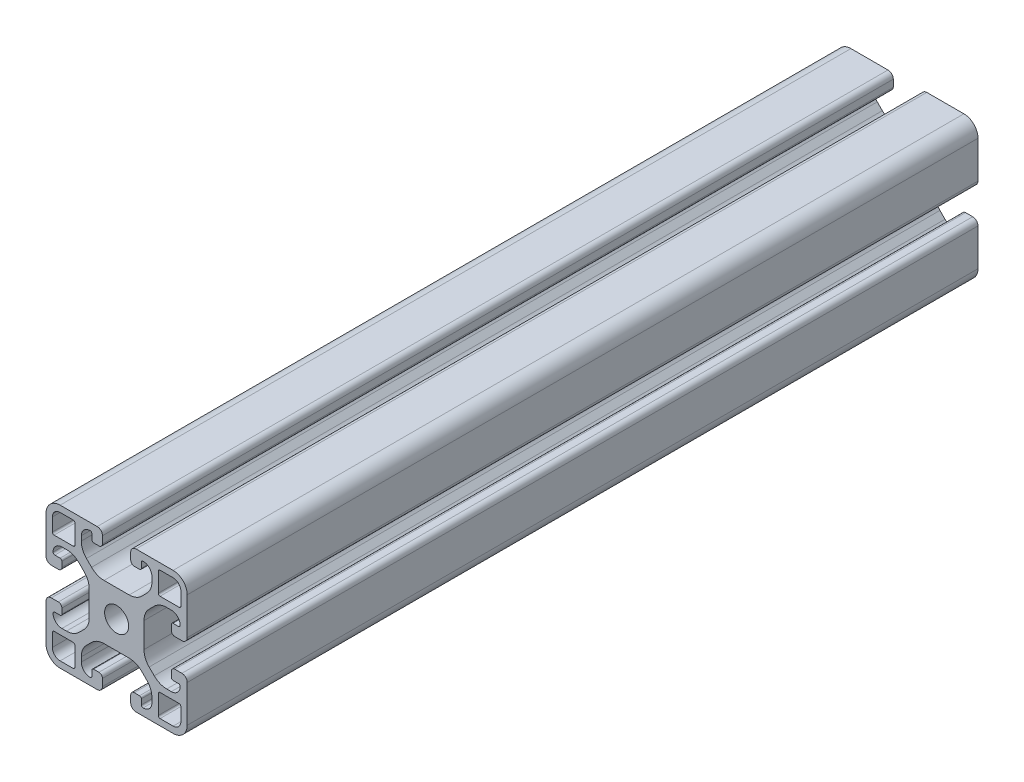
from build123d import *

# Parameters (mm, degrees)
ESQUISSE1_R      = 3.4
EXTRUSION1_DEPTH = 224


with BuildPart() as part:
    # Esquisse1 → Extrusion1 (new body)
    with BuildSketch(Plane.XY.offset(20)):
        with BuildLine():
            Line((3.5, 16), (1.5, 16))
            ThreePointArc((1.5, 16), (0.439339828, 15.560660172), (0, 14.5))
            Line((0, 14.5), (0, 4))
            ThreePointArc((0, 4), (1.171572875, 1.171572875), (4, 0))
            Line((4, 0), (14.5, 0))
            ThreePointArc((14.5, 0), (15.560660172, 0.439339828), (16, 1.5))
            Line((16, 1.5), (16, 3.5))
            ThreePointArc((16, 3.5), (15.707106781, 4.207106781), (15, 4.5))
            Line((15, 4.5), (13.5, 4.5))
            ThreePointArc((13.5, 4.5), (13.146446609, 4.353553391), (13, 4))
            Line((13, 4), (13, 2.5))
            ThreePointArc((13, 2.5), (12.853553391, 2.146446609), (12.5, 2))
            ThreePointArc((12.5, 2), (10.732233047, 2.732233047), (10, 4.5))
            Line((10, 4.5), (10, 5.807611845))
            ThreePointArc((10, 5.807611845), (10.380602337, 7.721029006), (11.464466094, 9.343145751))
            Line((11.464466094, 9.343145751), (12.906854249, 10.785533906))
            ThreePointArc((12.906854249, 10.785533906), (14.528970994, 11.869397663), (16.442388155, 12.25))
            Line((16.442388155, 12.25), (23.557611845, 12.25))
            ThreePointArc((23.557611845, 12.25), (25.471029006, 11.869397663), (27.093145751, 10.785533906))
            Line((27.093145751, 10.785533906), (28.535533906, 9.343145751))
            ThreePointArc((28.535533906, 9.343145751), (29.619397663, 7.721029006), (30, 5.807611845))
            Line((30, 5.807611845), (30, 4.5))
            ThreePointArc((30, 4.5), (29.267766953, 2.732233047), (27.5, 2))
            ThreePointArc((27.5, 2), (27.146446609, 2.146446609), (27, 2.5))
            Line((27, 2.5), (27, 4))
            ThreePointArc((27, 4), (26.853553391, 4.353553391), (26.5, 4.5))
            Line((26.5, 4.5), (25, 4.5))
            ThreePointArc((25, 4.5), (24.292893219, 4.207106781), (24, 3.5))
            Line((24, 3.5), (24, 1.5))
            ThreePointArc((24, 1.5), (24.439339828, 0.439339828), (25.5, 0))
            Line((25.5, 0), (36, 0))
            ThreePointArc((36, 0), (38.828427125, 1.171572875), (40, 4))
            Line((40, 4), (40, 14.5))
            ThreePointArc((40, 14.5), (39.560660172, 15.560660172), (38.5, 16))
            Line((38.5, 16), (36.5, 16))
            ThreePointArc((36.5, 16), (35.792893219, 15.707106781), (35.5, 15))
            Line((35.5, 15), (35.5, 13.5))
            ThreePointArc((35.5, 13.5), (35.646446609, 13.146446609), (36, 13))
            Line((36, 13), (37.5, 13))
            ThreePointArc((37.5, 13), (37.853553391, 12.853553391), (38, 12.5))
            ThreePointArc((38, 12.5), (37.267766953, 10.732233047), (35.5, 10))
            Line((35.5, 10), (34.192388155, 10))
            ThreePointArc((34.192388155, 10), (32.278970994, 10.380602337), (30.656854249, 11.464466094))
            Line((30.656854249, 11.464466094), (29.214466094, 12.906854249))
            ThreePointArc((29.214466094, 12.906854249), (28.130602337, 14.528970994), (27.75, 16.442388155))
            Line((27.75, 16.442388155), (27.75, 23.557611845))
            ThreePointArc((27.75, 23.557611845), (28.130602337, 25.471029006), (29.214466094, 27.093145751))
            Line((29.214466094, 27.093145751), (30.656854249, 28.535533906))
            ThreePointArc((30.656854249, 28.535533906), (32.278970994, 29.619397663), (34.192388155, 30))
            Line((34.192388155, 30), (35.5, 30))
            ThreePointArc((35.5, 30), (37.267766953, 29.267766953), (38, 27.5))
            ThreePointArc((38, 27.5), (37.853553391, 27.146446609), (37.5, 27))
            Line((37.5, 27), (36, 27))
            ThreePointArc((36, 27), (35.646446609, 26.853553391), (35.5, 26.5))
            Line((35.5, 26.5), (35.5, 25))
            ThreePointArc((35.5, 25), (35.792893219, 24.292893219), (36.5, 24))
            Line((36.5, 24), (38.5, 24))
            ThreePointArc((38.5, 24), (39.560660172, 24.439339828), (40, 25.5))
            Line((40, 25.5), (40, 36))
            ThreePointArc((40, 36), (38.828427125, 38.828427125), (36, 40))
            Line((36, 40), (25.5, 40))
            ThreePointArc((25.5, 40), (24.439339828, 39.560660172), (24, 38.5))
            Line((24, 38.5), (24, 36.5))
            ThreePointArc((24, 36.5), (24.292893219, 35.792893219), (25, 35.5))
            Line((25, 35.5), (26.5, 35.5))
            ThreePointArc((26.5, 35.5), (26.853553391, 35.646446609), (27, 36))
            Line((27, 36), (27, 37.5))
            ThreePointArc((27, 37.5), (27.146446609, 37.853553391), (27.5, 38))
            ThreePointArc((27.5, 38), (29.267766953, 37.267766953), (30, 35.5))
            Line((30, 35.5), (30, 34.192388155))
            ThreePointArc((30, 34.192388155), (29.619397663, 32.278970994), (28.535533906, 30.656854249))
            Line((28.535533906, 30.656854249), (27.093145751, 29.214466094))
            ThreePointArc((27.093145751, 29.214466094), (25.471029006, 28.130602337), (23.557611845, 27.75))
            Line((23.557611845, 27.75), (16.442388155, 27.75))
            ThreePointArc((16.442388155, 27.75), (14.528970994, 28.130602337), (12.906854249, 29.214466094))
            Line((12.906854249, 29.214466094), (11.464466094, 30.656854249))
            ThreePointArc((11.464466094, 30.656854249), (10.380602337, 32.278970994), (10, 34.192388155))
            Line((10, 34.192388155), (10, 35.5))
            ThreePointArc((10, 35.5), (10.732233047, 37.267766953), (12.5, 38))
            ThreePointArc((12.5, 38), (12.853553391, 37.853553391), (13, 37.5))
            Line((13, 37.5), (13, 36))
            ThreePointArc((13, 36), (13.146446609, 35.646446609), (13.5, 35.5))
            Line((13.5, 35.5), (15, 35.5))
            ThreePointArc((15, 35.5), (15.707106781, 35.792893219), (16, 36.5))
            Line((16, 36.5), (16, 38.5))
            ThreePointArc((16, 38.5), (15.560660172, 39.560660172), (14.5, 40))
            Line((14.5, 40), (4, 40))
            ThreePointArc((4, 40), (1.171572875, 38.828427125), (0, 36))
            Line((0, 36), (0, 25.5))
            ThreePointArc((0, 25.5), (0.439339828, 24.439339828), (1.5, 24))
            Line((1.5, 24), (3.5, 24))
            ThreePointArc((3.5, 24), (4.207106781, 24.292893219), (4.5, 25))
            Line((4.5, 25), (4.5, 26.5))
            ThreePointArc((4.5, 26.5), (4.353553391, 26.853553391), (4, 27))
            Line((4, 27), (2.5, 27))
            ThreePointArc((2.5, 27), (2.146446609, 27.146446609), (2, 27.5))
            ThreePointArc((2, 27.5), (2.732233047, 29.267766953), (4.5, 30))
            Line((4.5, 30), (5.807611845, 30))
            ThreePointArc((5.807611845, 30), (7.721029006, 29.619397663), (9.343145751, 28.535533906))
            Line((9.343145751, 28.535533906), (10.785533906, 27.093145751))
            ThreePointArc((10.785533906, 27.093145751), (11.869397663, 25.471029006), (12.25, 23.557611845))
            Line((12.25, 23.557611845), (12.25, 16.442388155))
            ThreePointArc((12.25, 16.442388155), (11.869397663, 14.528970994), (10.785533906, 12.906854249))
            Line((10.785533906, 12.906854249), (9.343145751, 11.464466094))
            ThreePointArc((9.343145751, 11.464466094), (7.721029006, 10.380602337), (5.807611845, 10))
            Line((5.807611845, 10), (4.5, 10))
            ThreePointArc((4.5, 10), (2.732233047, 10.732233047), (2, 12.5))
            ThreePointArc((2, 12.5), (2.146446609, 12.853553391), (2.5, 13))
            Line((2.5, 13), (4, 13))
            ThreePointArc((4, 13), (4.353553391, 13.146446609), (4.5, 13.5))
            Line((4.5, 13.5), (4.5, 15))
            ThreePointArc((4.5, 15), (4.207106781, 15.707106781), (3.5, 16))
        make_face()
        with Locations(Location((20, 20, 0), (0, 0, 180))):
            Circle(ESQUISSE1_R, mode=Mode.SUBTRACT)
        with BuildLine():
            Line((1.8, 4), (1.8, 7.7))
            ThreePointArc((1.8, 7.7), (1.946446609, 8.053553391), (2.3, 8.2))
            Line((2.3, 8.2), (7.7, 8.2))
            ThreePointArc((7.7, 8.2), (8.053553391, 8.053553391), (8.2, 7.7))
            Line((8.2, 7.7), (8.2, 2.3))
            ThreePointArc((8.2, 2.3), (8.053553391, 1.946446609), (7.7, 1.8))
            Line((7.7, 1.8), (4, 1.8))
            ThreePointArc((4, 1.8), (2.444365081, 2.444365081), (1.8, 4))
        make_face(mode=Mode.SUBTRACT)
        with BuildLine():
            Line((36, 1.8), (32.3, 1.8))
            ThreePointArc((32.3, 1.8), (31.946446609, 1.946446609), (31.8, 2.3))
            Line((31.8, 2.3), (31.8, 7.7))
            ThreePointArc((31.8, 7.7), (31.946446609, 8.053553391), (32.3, 8.2))
            Line((32.3, 8.2), (37.7, 8.2))
            ThreePointArc((37.7, 8.2), (38.053553391, 8.053553391), (38.2, 7.7))
            Line((38.2, 7.7), (38.2, 4))
            ThreePointArc((38.2, 4), (37.555634919, 2.444365081), (36, 1.8))
        make_face(mode=Mode.SUBTRACT)
        with BuildLine():
            Line((38.2, 36), (38.2, 32.3))
            ThreePointArc((38.2, 32.3), (38.053553391, 31.946446609), (37.7, 31.8))
            Line((37.7, 31.8), (32.3, 31.8))
            ThreePointArc((32.3, 31.8), (31.946446609, 31.946446609), (31.8, 32.3))
            Line((31.8, 32.3), (31.8, 37.7))
            ThreePointArc((31.8, 37.7), (31.946446609, 38.053553391), (32.3, 38.2))
            Line((32.3, 38.2), (36, 38.2))
            ThreePointArc((36, 38.2), (37.555634919, 37.555634919), (38.2, 36))
        make_face(mode=Mode.SUBTRACT)
        with BuildLine():
            Line((4, 38.2), (7.7, 38.2))
            ThreePointArc((7.7, 38.2), (8.053553391, 38.053553391), (8.2, 37.7))
            Line((8.2, 37.7), (8.2, 32.3))
            ThreePointArc((8.2, 32.3), (8.053553391, 31.946446609), (7.7, 31.8))
            Line((7.7, 31.8), (2.3, 31.8))
            ThreePointArc((2.3, 31.8), (1.946446609, 31.946446609), (1.8, 32.3))
            Line((1.8, 32.3), (1.8, 36))
            ThreePointArc((1.8, 36), (2.444365081, 37.555634919), (4, 38.2))
        make_face(mode=Mode.SUBTRACT)
    extrude(amount=-EXTRUSION1_DEPTH)


solid = part.part
